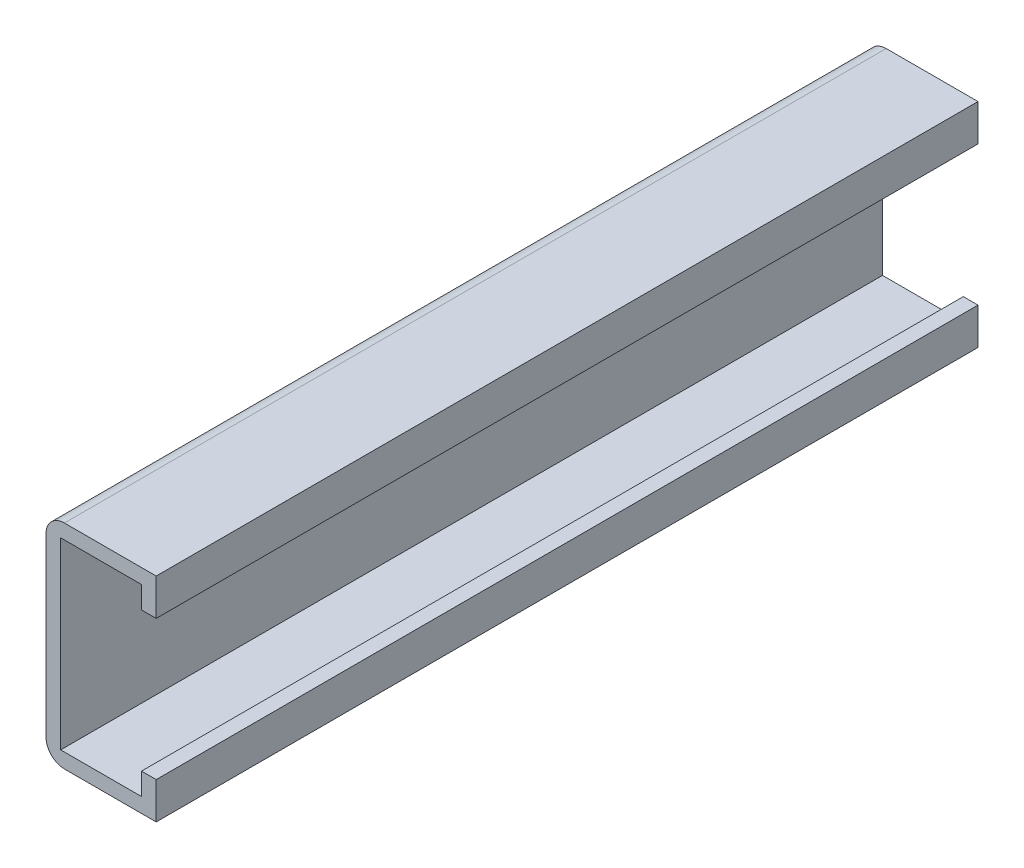
from build123d import *

# Parameters (mm, degrees)
SALIENTE_EXTRUIR1_DEPTH = 223.76
REDONDEO2_R             = 5


with BuildPart() as part:
    # Croquis1 → Saliente-Extruir1 (new body)
    with BuildSketch(Plane.XY):
        Polygon((11, 19), (15, 19), (15, 29), (-15, 29), (-15, -29), (15, -29), (15, -19), (11, -19), (11, -25), (-11, -25), (-11, 25), (11, 25), align=None)
    extrude(amount=-SALIENTE_EXTRUIR1_DEPTH)

    # Redondeo2
    redondeo2_edges = [part.edges().sort_by_distance(p)[0] for p in [
        (-15, 29, -111.88),
        (-15, -29, -111.88),
    ]]
    fillet(redondeo2_edges, radius=REDONDEO2_R)


solid = part.part
